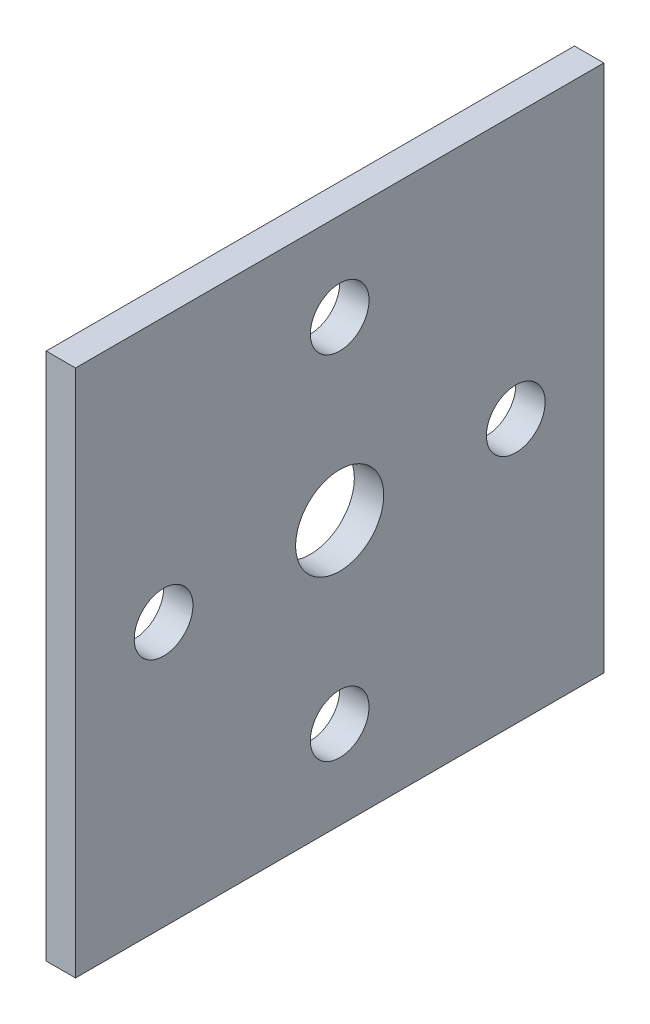
from build123d import *

# Parameters (mm, degrees)
SKETCH1_W           = 57.15
SKETCH1_H           = 57.15
SKETCH1_R           = 4.7625
BOSS_EXTRUDE1_DEPTH = 3.175
SKETCH2_R           = 3.175
CUT_EXTRUDE1_DEPTH  = 41.535686438
CIRPATTERN1_COUNT   = 4


with BuildPart() as part:
    # Sketch1 → Boss-Extrude1 (new body)
    with BuildSketch(Plane(origin=(0, 0, 0), x_dir=(0, 0, -1), z_dir=(1, 0, 0))):
        Rectangle(SKETCH1_W, SKETCH1_H)
        Circle(SKETCH1_R, mode=Mode.SUBTRACT)
    extrude(amount=BOSS_EXTRUDE1_DEPTH)

    # Sketch2 → Cut-Extrude1 (cut, through all)
    with BuildSketch(Plane(origin=(0, 0, 0), x_dir=(0, 0, -1), z_dir=(1, 0, 0))):
        with Locations((0, 19.05)):
            Circle(SKETCH2_R)
    cut_extrude1 = extrude(amount=CUT_EXTRUDE1_DEPTH, mode=Mode.SUBTRACT)

    # CirPattern1: Cut-Extrude1 ×4 about axis
    cirpattern1_axis = Axis((0, 0, 0), (1, 0, 0))
    for i in range(1, CIRPATTERN1_COUNT):
        add(cut_extrude1.rotate(cirpattern1_axis, i * 360 / CIRPATTERN1_COUNT), mode=Mode.SUBTRACT)


solid = part.part
